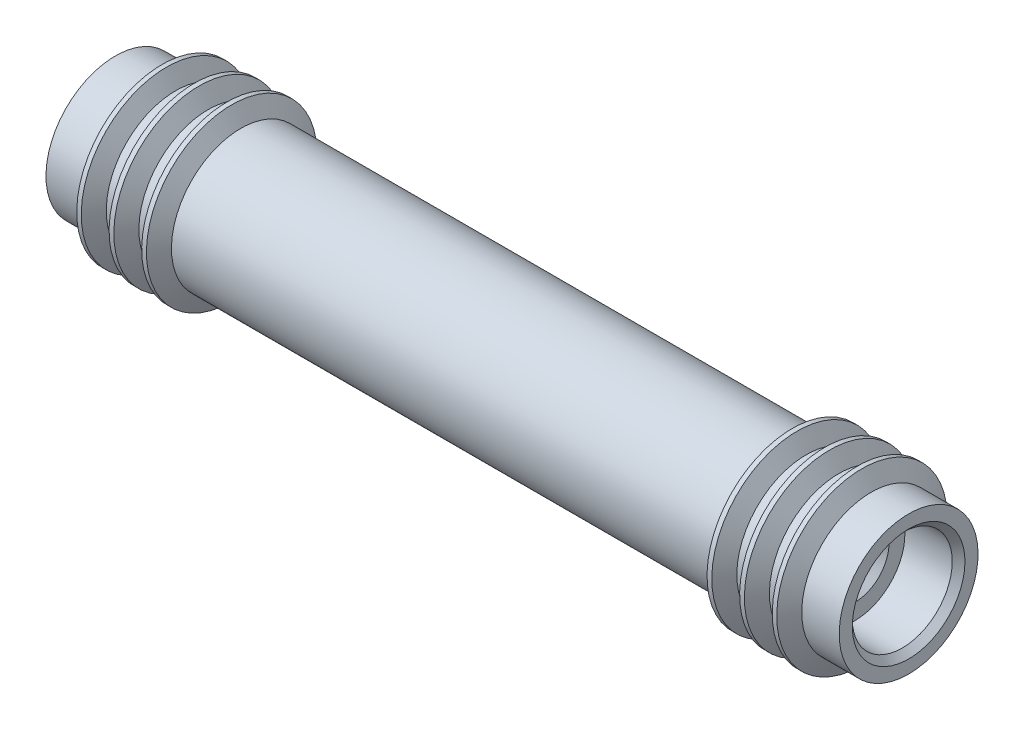
from build123d import *

# Parameters (mm, degrees)
CHAMFER1_SIZE = 0.508


with BuildPart() as part:
    # Sketch2 → Revolve1 (revolve)
    with BuildSketch(Plane.XY, mode=Mode.PRIVATE) as revolve1_sk:
        Polygon((-28.75, 5.55625), (-31.75, 5.55625), (-31.75, 4), (-27.45, 4), (-27.45, 2.73), (-26.942, 2.222), (-26.942, 1.7145), (-21.925, 1.7145), (-21.925, 0), (0, 0), (0, 3.175), (0, 5.55625), (-21.705060633, 5.55625), (-22.438295474, 6.82625), (-22.819295474, 6.82625), (-23.552530316, 5.55625), (-24.314530316, 5.55625), (-25.047765158, 6.82625), (-25.428765158, 6.82625), (-26.162, 5.55625), (-26.924, 5.55625), (-27.657234842, 6.82625), (-28.016765158, 6.82625), align=None)
    revolve(revolve1_sk.sketch.rotate(Axis((-31.75, 0, 0), (1, 0, 0)), 180), axis=Axis((-31.75, 0, 0), (1, 0, 0)))

    # Chamfer1
    chamfer1_edges = [part.edges().sort_by_distance(p)[0] for p in [
        (-31.75, 4, 0),
    ]]
    chamfer(chamfer1_edges, length=CHAMFER1_SIZE)

    # Mirror1: part across plane


with BuildPart() as part_1:
    add(part.part)
    add(part.part.mirror(Plane(origin=(0, 0, 0), x_dir=(0, 0, 1), z_dir=(1, 0, 0))))


solid = part_1.part
